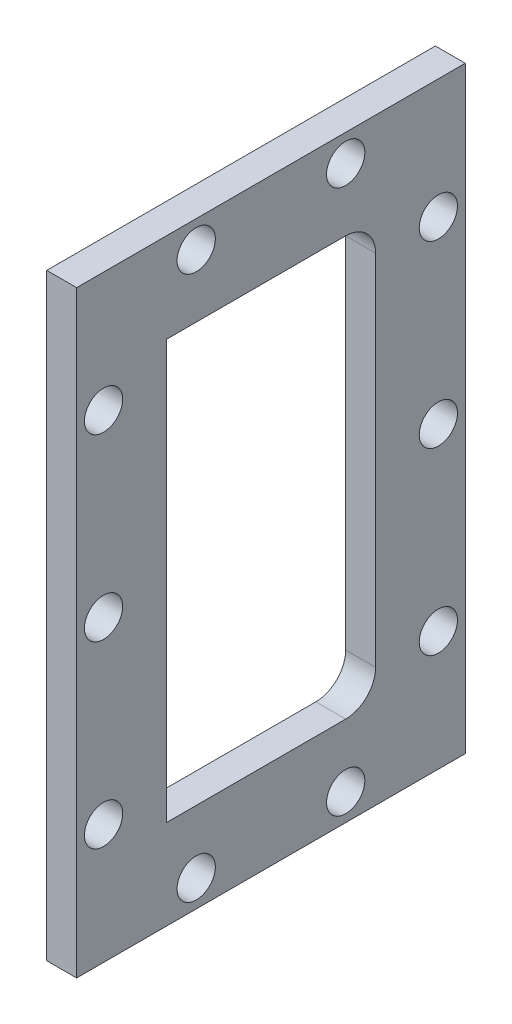
from build123d import *

# Parameters (mm, degrees)
SKETCH1_W           = 99.9998
SKETCH1_H           = 64.99987
BOSS_EXTRUDE1_DEPTH = 4.99999
CUT_EXTRUDE1_DEPTH  = 69.99986
HOLE1_D             = 6.3999872
FILLET1_R           = 4.99999


with BuildPart() as part:
    # Sketch1 → Boss-Extrude1 (new body)
    with BuildSketch(Plane(origin=(0, 0, 0), x_dir=(0, -1, 0), z_dir=(-1, 0, 0))):
        with Locations((-49.9999, 32.499935)):
            Rectangle(SKETCH1_W, SKETCH1_H)
    extrude(amount=-BOSS_EXTRUDE1_DEPTH)

    # Sketch2 → Cut-Extrude1 (cut)
    with BuildSketch(Plane.XZ.offset(-14.99997)):
        Polygon((0, 53.999892), (0, 14.99997), (4.99999, 14.99997), (4.99999, 49.9999), (3.999992, 49.9999), align=None)
    extrude(amount=-CUT_EXTRUDE1_DEPTH, mode=Mode.SUBTRACT)

    # Hole1 (through all)
    with Locations(Plane.ZY):
        with Locations((60.499879, 19.99996), (44.99991, 4.499991), (19.99996, 4.499991), (4.499991, 19.99996), (4.499991, 49.9999), (4.499991, 79.99984), (19.99996, 95.499809), (44.99991, 95.499809), (60.499879, 79.99984), (60.499879, 49.9999)):
            Hole(HOLE1_D / 2)

    # Fillet1
    fillet1_edges = [part.edges().sort_by_distance(p)[0] for p in [
        (2.499995, 84.99983, 14.99997),
        (2.499995, 14.99997, 14.99997),
    ]]
    fillet(fillet1_edges, radius=FILLET1_R)


solid = part.part
